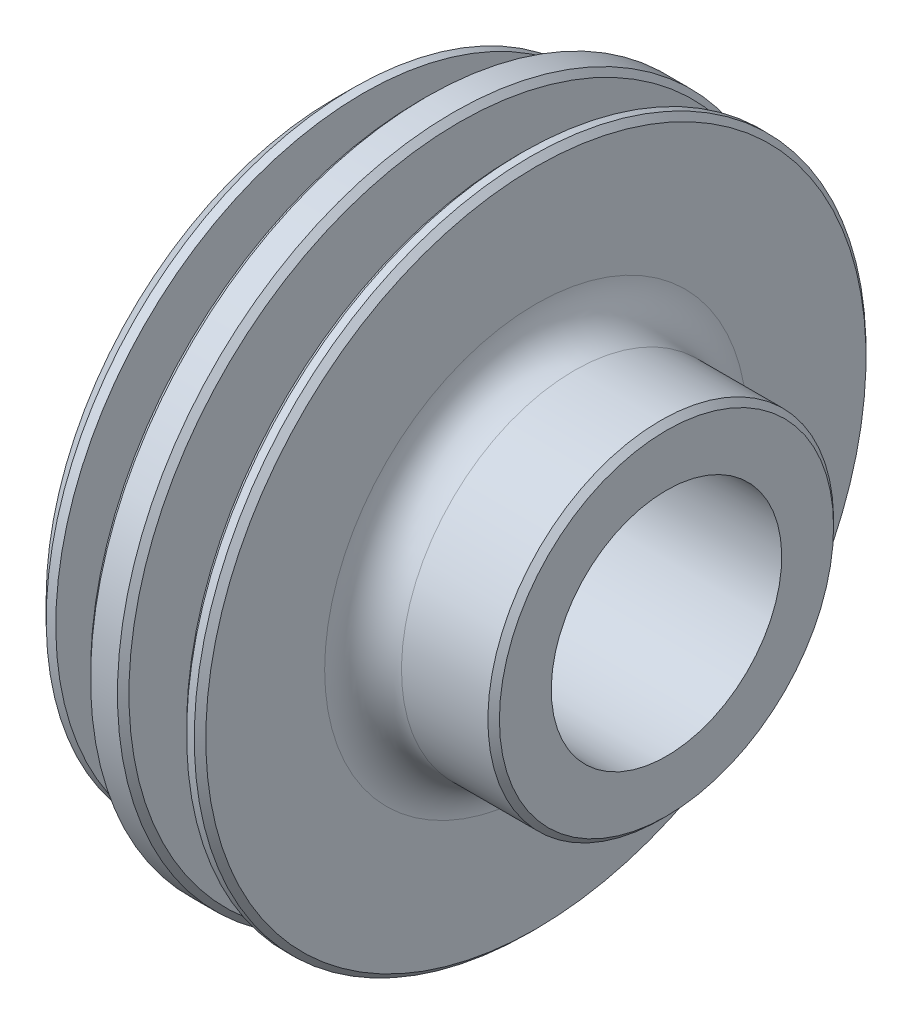
from build123d import *


with BuildPart() as part:
    # Esquisse1 → Révolution1 (revolve)
    with BuildSketch(Plane.XY):
        with BuildLine():
            Line((0, 0), (0, 8.5))
            Line((0, 8.5), (2.5, 11))
            Line((2.5, 11), (2.5, 15))
            Line((2.5, 15), (3.5, 16))
            Line((3.5, 16), (4, 16))
            Line((4, 16), (4, 12.826466888))
            Line((4, 12.826466888), (4, 11.5))
            Line((4, 11.5), (7, 11.5))
            Line((7, 11.5), (7, 17.18964629))
            Line((7, 17.18964629), (7.3, 17.48964629))
            Line((7.3, 17.48964629), (8.7, 17.48964629))
            Line((8.7, 17.48964629), (9, 17.18964629))
            Line((9, 17.18964629), (9, 12))
            Line((9, 12), (12, 12))
            Line((12, 12), (12, 17.18964629))
            Line((12, 17.18964629), (12.3, 17.48964629))
            Line((12.3, 17.48964629), (12.7, 17.48964629))
            Line((12.7, 17.48964629), (13, 17.18964629))
            Line((13, 17.18964629), (13, 11))
            ThreePointArc((13, 11), (13.585786438, 9.585786438), (15, 9))
            Line((15, 9), (19.5, 9))
            Line((19.5, 9), (19.8, 8.7))
            Line((19.8, 8.7), (19.8, 6))
            Line((19.8, 6), (7.8, 6))
            Line((7.8, 6), (7.8, 0))
            Line((7.8, 0), (0, 0))
        make_face()
    revolve(axis=Axis((7.8, 0, 0), (-1, 0, 0)))


solid = part.part
